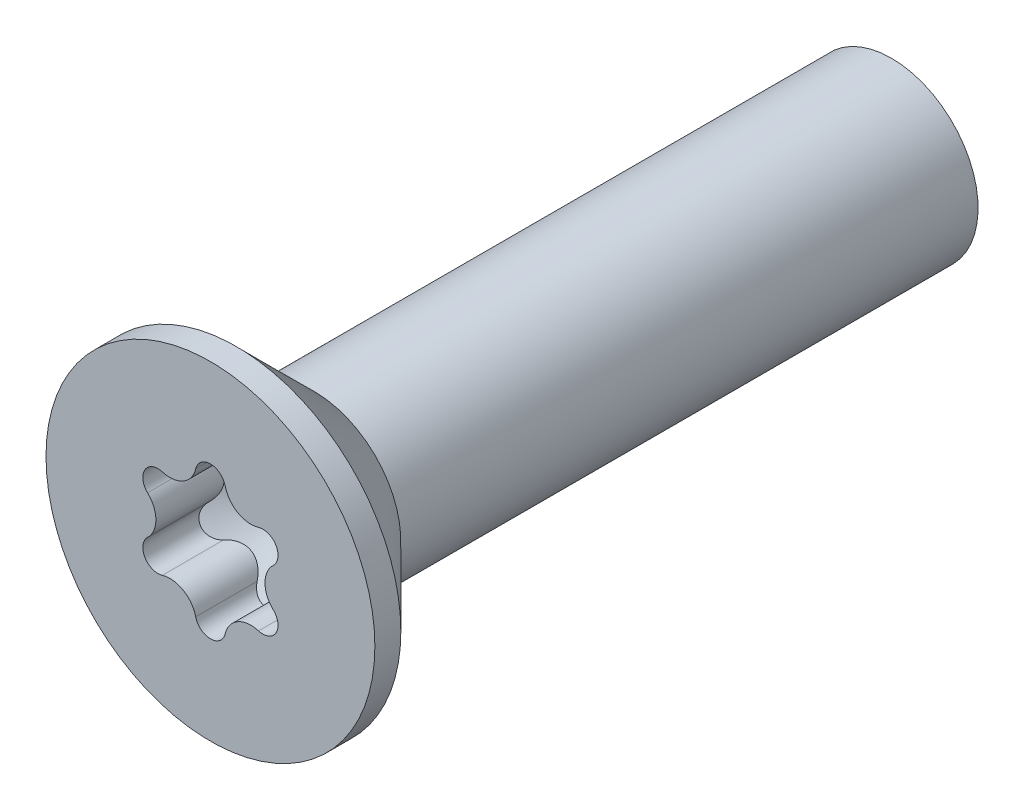
from build123d import *

# Parameters (mm, degrees)
HEXALOBULAR_REACH = 10.439


with BuildPart() as part:
    # BodySke → Base-Revolve (revolve)
    with BuildSketch(Plane(origin=(0, 0, 0), x_dir=(0, 0, -1), z_dir=(1, 0, 0)), mode=Mode.PRIVATE) as base_revolve_sk:
        Polygon((0, 0), (0, 1.9), (0.3, 1.9), (1.2, 1), (8, 1), (8, 0), align=None)
    revolve(base_revolve_sk.sketch.rotate(Axis((0, 0, 0), (0, 0, 1)), 90), axis=Axis((0, 0, 0), (0, 0, 1)))

    # PreBSke → PreBroach (revolve, cut)
    with BuildSketch(Plane(origin=(0, 0, 0), x_dir=(0, 0, -1), z_dir=(1, 0, 0)), mode=Mode.PRIVATE) as prebroach_sk:
        Polygon((0, 0), (0, 0.875), (0.64, 0.875), (1.165753042, 0), align=None)
    revolve(prebroach_sk.sketch.rotate(Axis((0, 0, 0), (0, 0, 1)), 90), axis=Axis((0, 0, 0), (0, 0, 1)), mode=Mode.SUBTRACT)

    # Hexalobular: up to this cone (the profile starts inside it)
    hexalobular_end = Plane(origin=(0, 0, 0), z_dir=(0, 0, 1)).offset(-1.165752042) * Cone(1.664e-06, 23.374625438, 14.04489091, align=(Align.CENTER, Align.CENTER, Align.MIN), mode=Mode.PRIVATE)
    # HexSke → Hexalobular (add, up to the surface)
    with BuildSketch(Plane.XY, mode=Mode.PRIVATE) as hexalobular_sk1:
        with BuildLine():
            ThreePointArc((-0.757772228, -0.4375), (-0.779371934, -0.324649655), (-0.726328785, -0.222727273))
            ThreePointArc((-0.726328785, -0.222727273), (-0.630273039, 0), (-0.726328785, 0.222727273))
            ThreePointArc((-0.726328785, 0.222727273), (-0.779371934, 0.324649655), (-0.757772228, 0.4375))
            ThreePointArc((-0.757772228, 0.4375), (-0.875, 0), (-0.757772228, -0.4375))
        make_face()
    hexalobular_tool1 = extrude(hexalobular_sk1.sketch, amount=-HEXALOBULAR_REACH, mode=Mode.PRIVATE) & hexalobular_end
    add(hexalobular_tool1.solids().sort_by_distance((-0.76612, 0, 0))[0])
    # HexSke → Hexalobular (add, up to the surface)
    with BuildSketch(Plane.XY, mode=Mode.PRIVATE) as hexalobular_sk2:
        with BuildLine():
            ThreePointArc((0, 0.875), (-0.4375, 0.757772228), (-0.757772228, 0.4375))
            ThreePointArc((-0.757772228, 0.4375), (-0.670840815, 0.512631066), (-0.556051869, 0.517655543))
            ThreePointArc((-0.556051869, 0.517655543), (-0.31513652, 0.545832463), (-0.170276916, 0.740382816))
            ThreePointArc((-0.170276916, 0.740382816), (-0.108531118, 0.837280721), (0, 0.875))
        make_face()
    hexalobular_tool2 = extrude(hexalobular_sk2.sketch, amount=-HEXALOBULAR_REACH, mode=Mode.PRIVATE) & hexalobular_end
    add(hexalobular_tool2.solids().sort_by_distance((-0.38306, 0.66348, 0))[0])
    # HexSke → Hexalobular (add, up to the surface)
    with BuildSketch(Plane.XY, mode=Mode.PRIVATE) as hexalobular_sk3:
        with BuildLine():
            ThreePointArc((0.757772228, 0.4375), (0.4375, 0.757772228), (0, 0.875))
            ThreePointArc((0, 0.875), (0.108531118, 0.837280721), (0.170276916, 0.740382816))
            ThreePointArc((0.170276916, 0.740382816), (0.31513652, 0.545832463), (0.556051869, 0.517655543))
            ThreePointArc((0.556051869, 0.517655543), (0.670840815, 0.512631066), (0.757772228, 0.4375))
        make_face()
    hexalobular_tool3 = extrude(hexalobular_sk3.sketch, amount=-HEXALOBULAR_REACH, mode=Mode.PRIVATE) & hexalobular_end
    add(hexalobular_tool3.solids().sort_by_distance((0.38306, 0.66348, 0))[0])
    # HexSke → Hexalobular (add, up to the surface)
    with BuildSketch(Plane.XY, mode=Mode.PRIVATE) as hexalobular_sk4:
        with BuildLine():
            ThreePointArc((0.726328785, -0.222727273), (0.779371934, -0.324649655), (0.757772228, -0.4375))
            ThreePointArc((0.757772228, -0.4375), (0.845185098, -0.226466664), (0.875, 0))
            ThreePointArc((0.875, 0), (0.845185098, 0.226466664), (0.757772228, 0.4375))
            ThreePointArc((0.757772228, 0.4375), (0.779371934, 0.324649655), (0.726328785, 0.222727273))
            ThreePointArc((0.726328785, 0.222727273), (0.630273039, 0), (0.726328785, -0.222727273))
        make_face()
    hexalobular_tool4 = extrude(hexalobular_sk4.sketch, amount=-HEXALOBULAR_REACH, mode=Mode.PRIVATE) & hexalobular_end
    add(hexalobular_tool4.solids().sort_by_distance((0.76612, 0, 0))[0])
    # HexSke → Hexalobular (add, up to the surface)
    with BuildSketch(Plane.XY, mode=Mode.PRIVATE) as hexalobular_sk5:
        with BuildLine():
            ThreePointArc((0.170276916, -0.740382816), (0.108531118, -0.837280721), (0, -0.875))
            ThreePointArc((0, -0.875), (0.4375, -0.757772228), (0.757772228, -0.4375))
            ThreePointArc((0.757772228, -0.4375), (0.670840815, -0.512631066), (0.556051869, -0.517655543))
            ThreePointArc((0.556051869, -0.517655543), (0.31513652, -0.545832463), (0.170276916, -0.740382816))
        make_face()
    hexalobular_tool5 = extrude(hexalobular_sk5.sketch, amount=-HEXALOBULAR_REACH, mode=Mode.PRIVATE) & hexalobular_end
    add(hexalobular_tool5.solids().sort_by_distance((0.38306, -0.66348, 0))[0])
    # HexSke → Hexalobular (add, up to the surface)
    with BuildSketch(Plane.XY, mode=Mode.PRIVATE) as hexalobular_sk6:
        with BuildLine():
            ThreePointArc((-0.556051869, -0.517655543), (-0.670840815, -0.512631066), (-0.757772228, -0.4375))
            ThreePointArc((-0.757772228, -0.4375), (-0.4375, -0.757772228), (0, -0.875))
            ThreePointArc((0, -0.875), (-0.108531118, -0.837280721), (-0.170276916, -0.740382816))
            ThreePointArc((-0.170276916, -0.740382816), (-0.31513652, -0.545832463), (-0.556051869, -0.517655543))
        make_face()
    hexalobular_tool6 = extrude(hexalobular_sk6.sketch, amount=-HEXALOBULAR_REACH, mode=Mode.PRIVATE) & hexalobular_end
    add(hexalobular_tool6.solids().sort_by_distance((-0.38306, -0.66348, 0))[0])

    # ThdSchSke → ThreadSchematic (revolve, cut)
    with BuildSketch(Plane(origin=(0, 0, 0), x_dir=(0, 0, -1), z_dir=(1, 0, 0))):
        Polygon((8.130481161, 1), (8, 0.774), (7.869518839, 1), align=None)
    revolve(axis=Axis((0, 0, 0), (0, 0, 1)), mode=Mode.SUBTRACT)


solid = part.part
